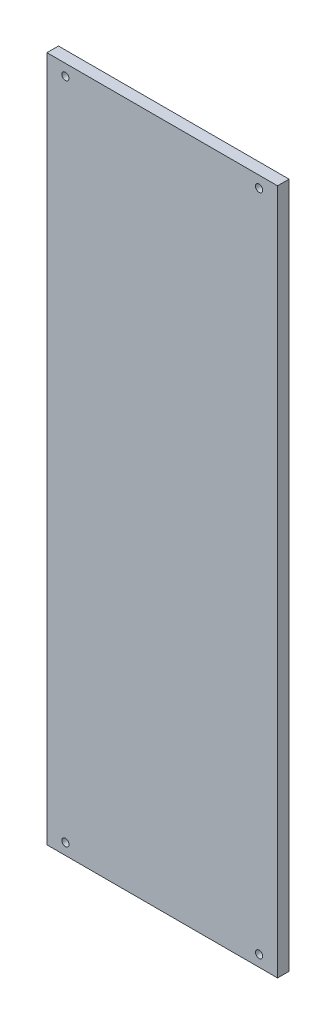
from build123d import *

# Parameters (mm, degrees)
SKETCH1_W                      = 254
SKETCH1_H                      = 755.65
BOSS_EXTRUDE1_DEPTH            = 12.7
F_5_16_0_3125_DIAMETER_HOLE1_D = 7.9375


with BuildPart() as part:
    # Sketch1 → Boss-Extrude1 (new body)
    with BuildSketch(Plane.XY):
        Rectangle(SKETCH1_W, SKETCH1_H)
    extrude(amount=BOSS_EXTRUDE1_DEPTH)

    # 5/16 (0.3125) Diameter Hole1 (through all)
    with Locations(Plane(origin=(0, 0, 0), x_dir=(-1, 0, 0), z_dir=(0, 0, -1))):
        with Locations((-106.68, 365.379), (106.68, 365.379), (-106.68, -365.379), (106.68, -365.379)):
            Hole(F_5_16_0_3125_DIAMETER_HOLE1_D / 2)


solid = part.part
